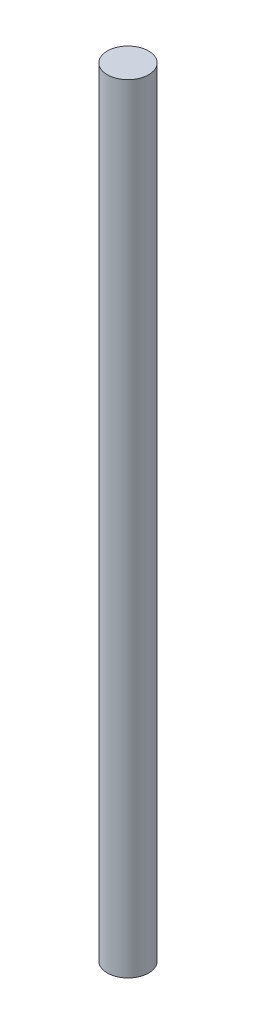
from build123d import *

# Parameters (mm, degrees)
SKETCH1_R           = 0.79375
BOSS_EXTRUDE1_DEPTH = 29.9085


with BuildPart() as part:
    # Sketch1 → Boss-Extrude1 (new body)
    with BuildSketch(Plane(origin=(0, 0, 0), x_dir=(1, 0, 0), z_dir=(0, 1, 0))):
        with Locations(Location((0, 0, 0), (0, 0, 270))):
            Circle(SKETCH1_R)
    extrude(amount=BOSS_EXTRUDE1_DEPTH)


solid = part.part
